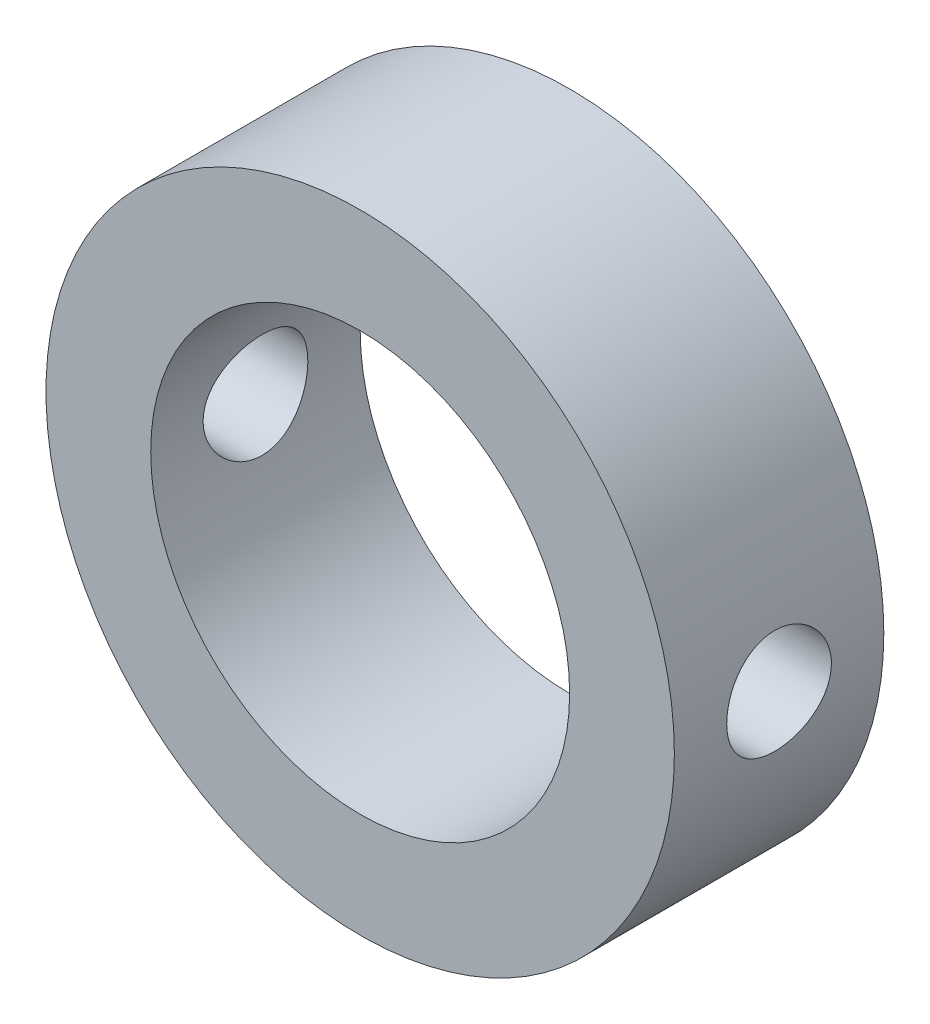
from build123d import *

# Parameters (mm, degrees)
SKETCH1_R           = 12
SKETCH1_R_2         = 8
BOSS_EXTRUDE1_DEPTH = 8
SKETCH2_R           = 2
CUT_EXTRUDE1_DEPTH  = 50


with BuildPart() as part:
    # Sketch1 → Boss-Extrude1 (new body)
    with BuildSketch(Plane.XY):
        Circle(SKETCH1_R)
        Circle(SKETCH1_R_2, mode=Mode.SUBTRACT)
    extrude(amount=BOSS_EXTRUDE1_DEPTH)

    # Sketch2 → Cut-Extrude1 (cut, symmetric)
    with BuildSketch(Plane(origin=(0, 0, 0), x_dir=(0, 0, -1), z_dir=(1, 0, 0))):
        with Locations((-4, 0)):
            Circle(SKETCH2_R)
    extrude(amount=CUT_EXTRUDE1_DEPTH, both=True, mode=Mode.SUBTRACT)


solid = part.part
